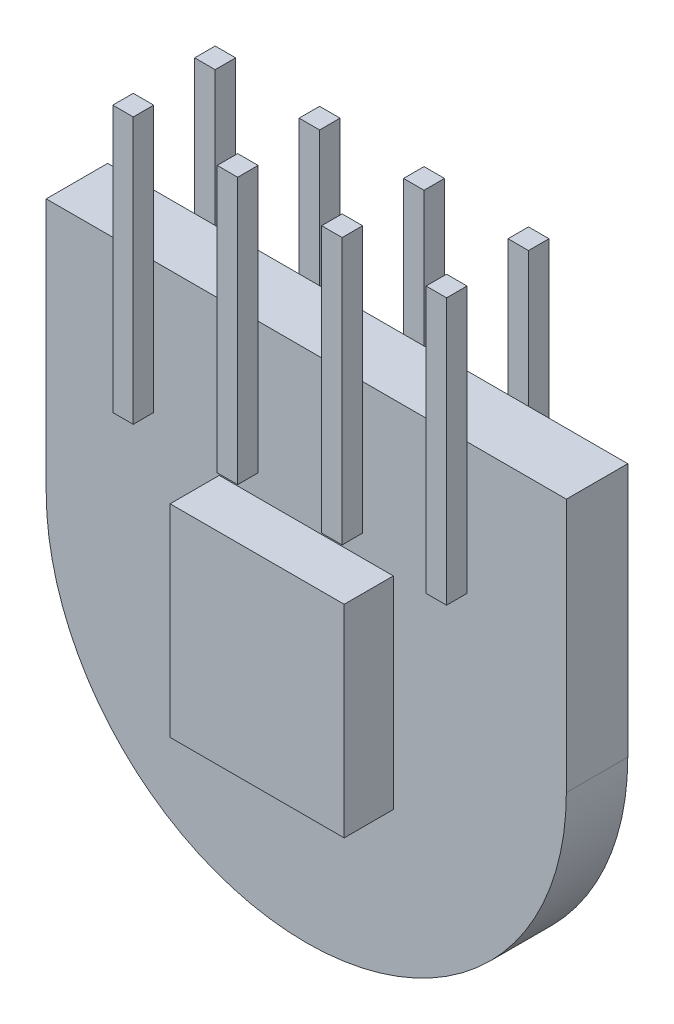
from build123d import *

# Parameters (mm, degrees)
P_IDAT_VYSUNUT_M1_DEPTH  = 1.5
P_IDAT_START             = 1.5
SKICA1_3_W               = 4.25
SKICA1_3_H               = 4.94
P_IDAT_VYSUNUT_M2_DEPTH  = 1.2
SKICA3_W                 = 12.7
SKICA3_H                 = 1.5
ODEBRAT_VYSUNUT_M1_DEPTH = 3.5
SKICA4_W                 = 12.7
SKICA4_H                 = 1.5
ODEBRAT_VYSUNUT_M2_DEPTH = 5.5
SKICA7_W                 = 12.7
SKICA7_H                 = 1.5
P_IDAT_VYSUNUT_M5_DEPTH  = 2.7055
P_IDAT_START_2           = 3
SKICA15_W                = 0.5
SKICA15_H                = 0.5
P_IDAT_VYSUNUT_M14_DEPTH = 6.5
LINPOLE3_COUNT           = 4
LINPOLE3_PITCH           = 2.55
LINPOLE4_COUNT           = 2
LINPOLE4_PITCH           = 2
LINPOLE4_START           = 3
LINPOLE4_COPY_1_SKETCH_W = 0.5
LINPOLE4_COPY_1_SKETCH_H = 0.5
LINPOLE4_COPY_1_DEPTH    = 6.5
LINPOLE4_COPY_2_SKETCH_W = 0.5
LINPOLE4_COPY_2_SKETCH_H = 0.5
LINPOLE4_COPY_2_DEPTH    = 6.5
LINPOLE4_COPY_3_SKETCH_W = 0.5
LINPOLE4_COPY_3_SKETCH_H = 0.5
LINPOLE4_COPY_3_DEPTH    = 6.5


with BuildPart() as part:
    # Skica1 → Přidat vysunutím1 (new body)
    with BuildSketch(Plane.XY):
        with BuildLine():
            Line((-6.35, 0), (-6.35, 12.5))
            Line((-6.35, 12.5), (6.35, 12.5))
            Line((6.35, 12.5), (6.35, 0))
            ThreePointArc((6.35, 0), (0, -6.35), (-6.35, 0))
        make_face()
    extrude(amount=P_IDAT_VYSUNUT_M1_DEPTH)

    # Skica1<3> → Přidat vysunutím2 (add)
    with BuildSketch(Plane.XY.offset(P_IDAT_START)):
        Rectangle(SKICA1_3_W, SKICA1_3_H)
    extrude(amount=P_IDAT_VYSUNUT_M2_DEPTH)

    # Skica3 → Odebrat vysunutím1 (cut)
    with BuildSketch(Plane(origin=(0, 12.5, 0), x_dir=(1, 0, 0), z_dir=(0, 1, 0))):
        with Locations((0, -0.75)):
            Rectangle(SKICA3_W, SKICA3_H)
    extrude(amount=-ODEBRAT_VYSUNUT_M1_DEPTH, mode=Mode.SUBTRACT)

    # Skica4 → Odebrat vysunutím2 (cut)
    with BuildSketch(Plane(origin=(0, 9, 0), x_dir=(1, 0, 0), z_dir=(0, 1, 0))):
        with Locations((0, -0.75)):
            Rectangle(SKICA4_W, SKICA4_H)
    extrude(amount=-ODEBRAT_VYSUNUT_M2_DEPTH, mode=Mode.SUBTRACT)

    # Skica7 → Přidat vysunutím5 (add)
    with BuildSketch(Plane(origin=(0, 3.5, 0), x_dir=(1, 0, 0), z_dir=(0, 1, 0))):
        with Locations((0, -0.75)):
            Rectangle(SKICA7_W, SKICA7_H)
    extrude(amount=P_IDAT_VYSUNUT_M5_DEPTH)

    # Skica15 → Přidat vysunutím14 (add)
    with BuildSketch(Plane(origin=(0, 0, 0), x_dir=(1, 0, 0), z_dir=(0, 1, 0)).offset(P_IDAT_START_2)):
        with Locations((-3.975, -1.75)):
            Rectangle(SKICA15_W, SKICA15_H)
    p_idat_vysunut_m14 = extrude(amount=P_IDAT_VYSUNUT_M14_DEPTH)

    # LinPole3: Přidat vysunutím14 ×4
    with Locations(*[(i * LINPOLE3_PITCH, 0, 0) for i in range(1, LINPOLE3_COUNT)]):
        add(p_idat_vysunut_m14)

    # LinPole4: Přidat vysunutím14 ×2
    with Locations(*[(0, 0, -i * LINPOLE4_PITCH) for i in range(1, LINPOLE4_COUNT)]):
        add(p_idat_vysunut_m14)

    # LinPole4 copy 1 sketch → LinPole4 copy 1 (add)
    with BuildSketch(Plane(origin=(2.55, 0, -2), x_dir=(1, 0, 0), z_dir=(0, 1, 0)).offset(LINPOLE4_START)):
        with Locations((-3.975, -1.75)):
            Rectangle(LINPOLE4_COPY_1_SKETCH_W, LINPOLE4_COPY_1_SKETCH_H)
    extrude(amount=LINPOLE4_COPY_1_DEPTH)

    # LinPole4 copy 2 sketch → LinPole4 copy 2 (add)
    with BuildSketch(Plane(origin=(5.1, 0, -2), x_dir=(1, 0, 0), z_dir=(0, 1, 0)).offset(LINPOLE4_START)):
        with Locations((-3.975, -1.75)):
            Rectangle(LINPOLE4_COPY_2_SKETCH_W, LINPOLE4_COPY_2_SKETCH_H)
    extrude(amount=LINPOLE4_COPY_2_DEPTH)

    # LinPole4 copy 3 sketch → LinPole4 copy 3 (add)
    with BuildSketch(Plane(origin=(7.65, 0, -2), x_dir=(1, 0, 0), z_dir=(0, 1, 0)).offset(LINPOLE4_START)):
        with Locations((-3.975, -1.75)):
            Rectangle(LINPOLE4_COPY_3_SKETCH_W, LINPOLE4_COPY_3_SKETCH_H)
    extrude(amount=LINPOLE4_COPY_3_DEPTH)


solid = part.part
